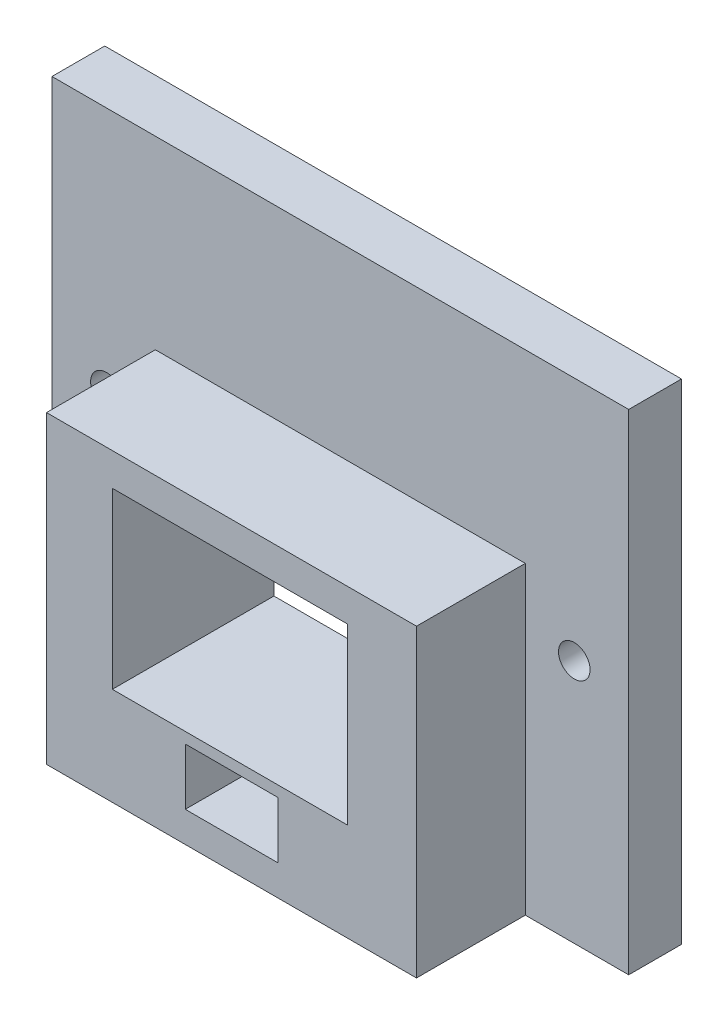
from build123d import *

# Parameters (mm, degrees)
CROQUIS1_W              = 53
CROQUIS1_H              = 45
CROQUIS1_W_2            = 21.614146676
CROQUIS1_H_2            = 16
CROQUIS1_W_3            = 8.5
CROQUIS1_H_3            = 5.2
SALIENTE_EXTRUIR1_DEPTH = 14.85
CROQUIS2_W              = 9.5
CROQUIS2_H              = 45
CORTAR_EXTRUIR1_DEPTH   = 10
CROQUIS3_W              = 34
CROQUIS3_H              = 17
CORTAR_EXTRUIR2_DEPTH   = 10
CROQUIS4_R              = 1.45
CORTAR_EXTRUIR3_DEPTH   = 10


with BuildPart() as part:
    # Croquis1 → Saliente-Extruir1 (new body)
    with BuildSketch(Plane.XY):
        Rectangle(CROQUIS1_W, CROQUIS1_H)
        with Locations((-0.142926662, -5.5)):
            Rectangle(CROQUIS1_W_2, CROQUIS1_H_2, mode=Mode.SUBTRACT)
        with Locations((0, -17.1)):
            Rectangle(CROQUIS1_W_3, CROQUIS1_H_3, mode=Mode.SUBTRACT)
    extrude(amount=SALIENTE_EXTRUIR1_DEPTH)

    # Croquis2 → Cortar-Extruir1 (cut)
    with BuildSketch(Plane.XY.offset(14.85)):
        with Locations((21.75, 0)):
            Rectangle(CROQUIS2_W, CROQUIS2_H)
        with Locations((-21.75, 0)):
            Rectangle(CROQUIS2_W, CROQUIS2_H)
    extrude(amount=-CORTAR_EXTRUIR1_DEPTH, mode=Mode.SUBTRACT)

    # Croquis3 → Cortar-Extruir2 (cut)
    with BuildSketch(Plane.XY.offset(14.85)):
        with Locations((0, 14)):
            Rectangle(CROQUIS3_W, CROQUIS3_H)
    extrude(amount=-CORTAR_EXTRUIR2_DEPTH, mode=Mode.SUBTRACT)

    # Croquis4 → Cortar-Extruir3 (cut)
    with BuildSketch(Plane.XY.offset(4.85)):
        with Locations((-21.5, 0)):
            Circle(CROQUIS4_R)
        with Locations((21.5, 0)):
            Circle(CROQUIS4_R)
    extrude(amount=-CORTAR_EXTRUIR3_DEPTH, mode=Mode.SUBTRACT)


solid = part.part
